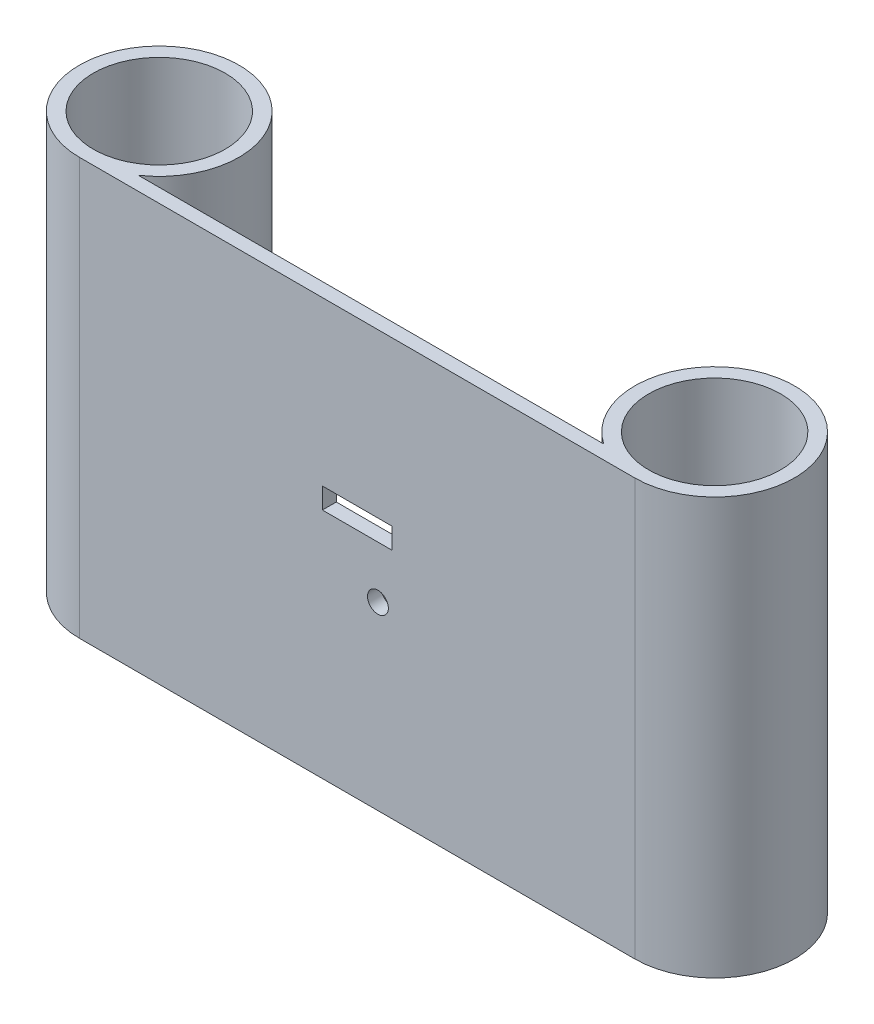
from build123d import *

# Parameters (mm, degrees)
BOSS_EXTRUDE1_DEPTH = 60
SKETCH2_R           = 9.5
CUT_EXTRUDE1_DEPTH  = 60
CUT_EXTRUDE2_DEPTH  = 60
BOSS_EXTRUDE3_DEPTH = 3
SKETCH5_R           = 4.1
CUT_EXTRUDE3_DEPTH  = 3
SKETCH6_R           = 1.5
CUT_EXTRUDE4_DEPTH  = 3
SKETCH8_R           = 1.5
SKETCH8_W           = 10
SKETCH8_H           = 3
CUT_EXTRUDE5_DEPTH  = 3
FILLET1_R           = 1


with BuildPart() as part:
    # Sketch1 → Boss-Extrude1 (new body)
    with BuildSketch(Plane(origin=(0, 0, 0), x_dir=(1, 0, 0), z_dir=(0, 1, 0))):
        with BuildLine():
            Line((-40, 11.5), (40, 11.5))
            ThreePointArc((40, 11.5), (51.5, 0), (40, -11.5))
            Line((40, -11.5), (-40, -11.5))
            ThreePointArc((-40, -11.5), (-51.5, 0), (-40, 11.5))
        make_face()
    extrude(amount=BOSS_EXTRUDE1_DEPTH)

    # Sketch2 → Cut-Extrude1 (cut)
    with BuildSketch(Plane.XZ):
        with Locations(Location((-40, 0, 0), (0, 0, 270))):
            Circle(SKETCH2_R)
        with Locations(Location((40, 0, 0), (0, 0, 270))):
            Circle(SKETCH2_R)
    extrude(amount=-CUT_EXTRUDE1_DEPTH, mode=Mode.SUBTRACT)

    # Sketch3 → Cut-Extrude2 (cut)
    with BuildSketch(Plane.XZ):
        with BuildLine():
            Line((33.519259302, 9.5), (-33.519259302, 9.5))
            ThreePointArc((-33.519259302, 9.5), (-29.831949104, 5.372219372), (-28.5, 0))
            ThreePointArc((-28.5, 0), (-31.868272016, -8.131727984), (-40, -11.5))
            Line((-40, -11.5), (40, -11.5))
            ThreePointArc((40, -11.5), (29.011369512, -3.391164992), (33.519259302, 9.5))
        make_face()
    extrude(amount=-CUT_EXTRUDE2_DEPTH, mode=Mode.SUBTRACT)

    # Sketch4 → Boss-Extrude3 (add)
    with BuildSketch(Plane.XZ):
        with BuildLine():
            Line((-33.519259302, 9.5), (33.519259302, 9.5))
            ThreePointArc((33.519259302, 9.5), (21.099049386, 5.75486124), (12.819526766, -4.231989308))
            ThreePointArc((12.819526766, -4.231989308), (0, -13.5), (-12.819526766, -4.231989308))
            ThreePointArc((-12.819526766, -4.231989308), (-21.099049386, 5.75486124), (-33.519259302, 9.5))
        make_face()
    extrude(amount=-BOSS_EXTRUDE3_DEPTH)

    # Sketch5 → Cut-Extrude3 (cut)
    with BuildSketch(Plane.XZ):
        with Locations(Location((0, 0, 0), (0, 0, 270))):
            Circle(SKETCH5_R)
    extrude(amount=-CUT_EXTRUDE3_DEPTH, mode=Mode.SUBTRACT)

    # Sketch6 → Cut-Extrude4 (cut)
    with BuildSketch(Plane.XZ):
        with Locations(Location((5.979202711, -6.041451394, 0), (0, 0, 270))):
            Circle(SKETCH6_R)
        with Locations(Location((-6.020797289, -6, 0), (0, 0, 270))):
            Circle(SKETCH6_R)
        with Locations(Location((-6.020797289, 6, 0), (0, 0, 270))):
            Circle(SKETCH6_R)
        with Locations(Location((5.979202711, 6.041451394, 0), (0, 0, 270))):
            Circle(SKETCH6_R)
    extrude(amount=-CUT_EXTRUDE4_DEPTH, mode=Mode.SUBTRACT)

    # Sketch8 → Cut-Extrude5 (cut)
    with BuildSketch(Plane.XY.offset(11.5)):
        with Locations((3, 26)):
            Circle(SKETCH8_R)
        with Locations((0, 35)):
            Rectangle(SKETCH8_W, SKETCH8_H)
    extrude(amount=-CUT_EXTRUDE5_DEPTH, mode=Mode.SUBTRACT)

    # Fillet1
    fillet1_edges = [part.edges().sort_by_distance(p)[0] for p in [
        (-40, 0, 9.5),
    ]]
    fillet(fillet1_edges, radius=FILLET1_R)


solid = part.part
